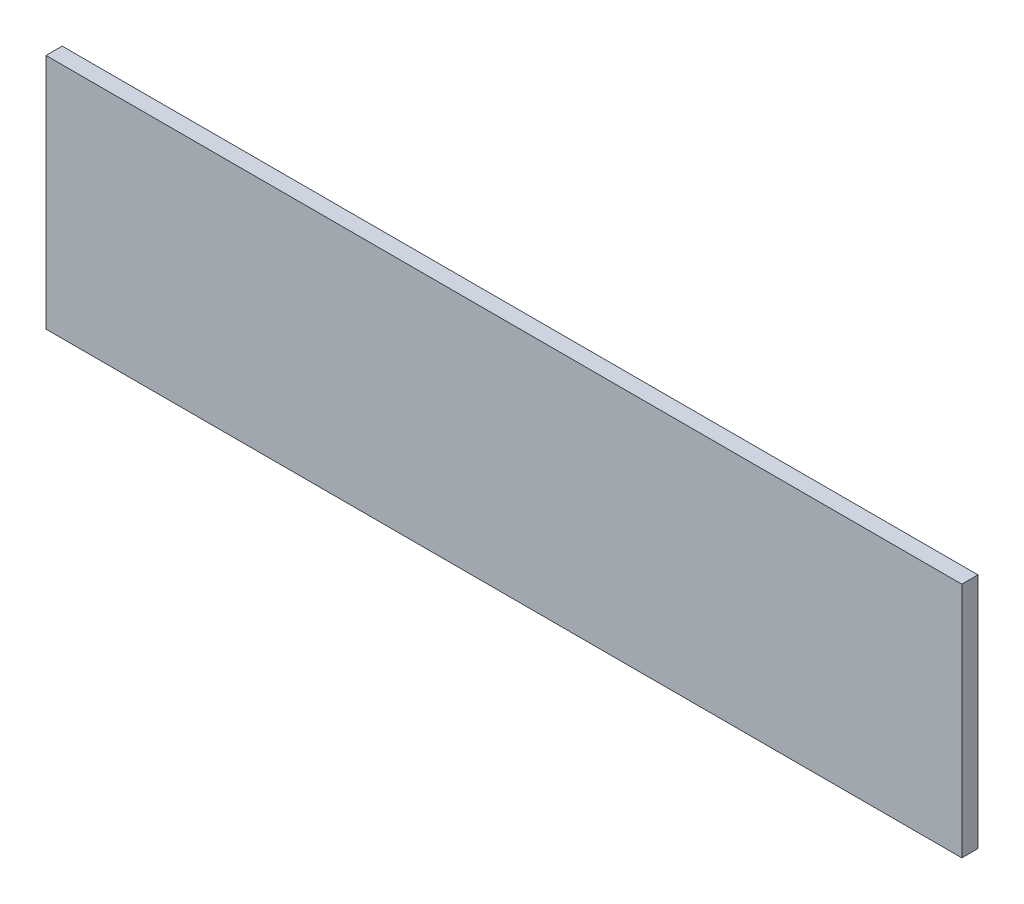
from build123d import *

# Parameters (mm, degrees)
SKETCH_1_W      = 170
SKETCH_1_H      = 44
EXTRUDE_1_DEPTH = 3


with BuildPart() as part:
    # 草图1 → 凸台-拉伸1 (new body)
    with BuildSketch(Plane.XY):
        with Locations((85, -22)):
            Rectangle(SKETCH_1_W, SKETCH_1_H)
    extrude(amount=EXTRUDE_1_DEPTH)


solid = part.part
